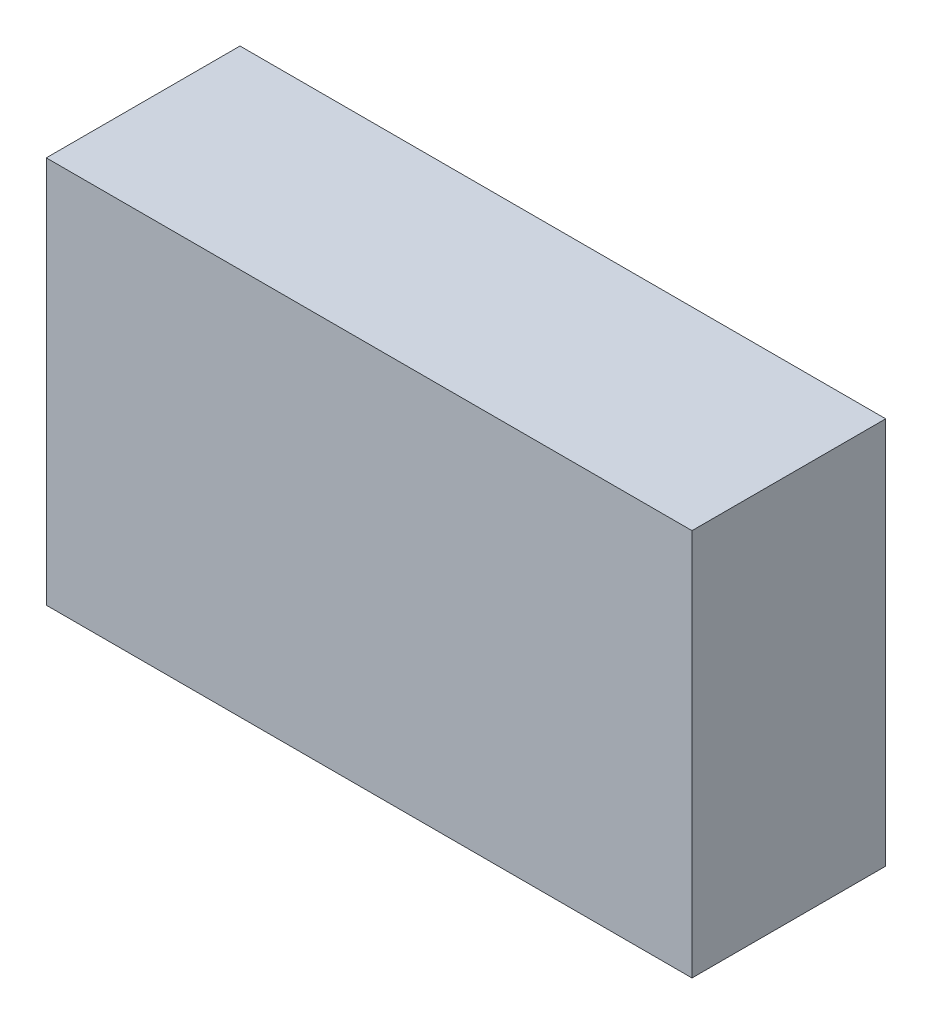
from build123d import *

# Parameters (mm, degrees)
SKETCH1_W          = 100
SKETCH1_H          = 60
BASE_EXTRUDE_DEPTH = 30


with BuildPart() as part:
    # Sketch1 → Base_Extrude (new body)
    with BuildSketch(Plane.XY):
        with Locations((50, 30)):
            Rectangle(SKETCH1_W, SKETCH1_H)
    extrude(amount=BASE_EXTRUDE_DEPTH)


solid = part.part
